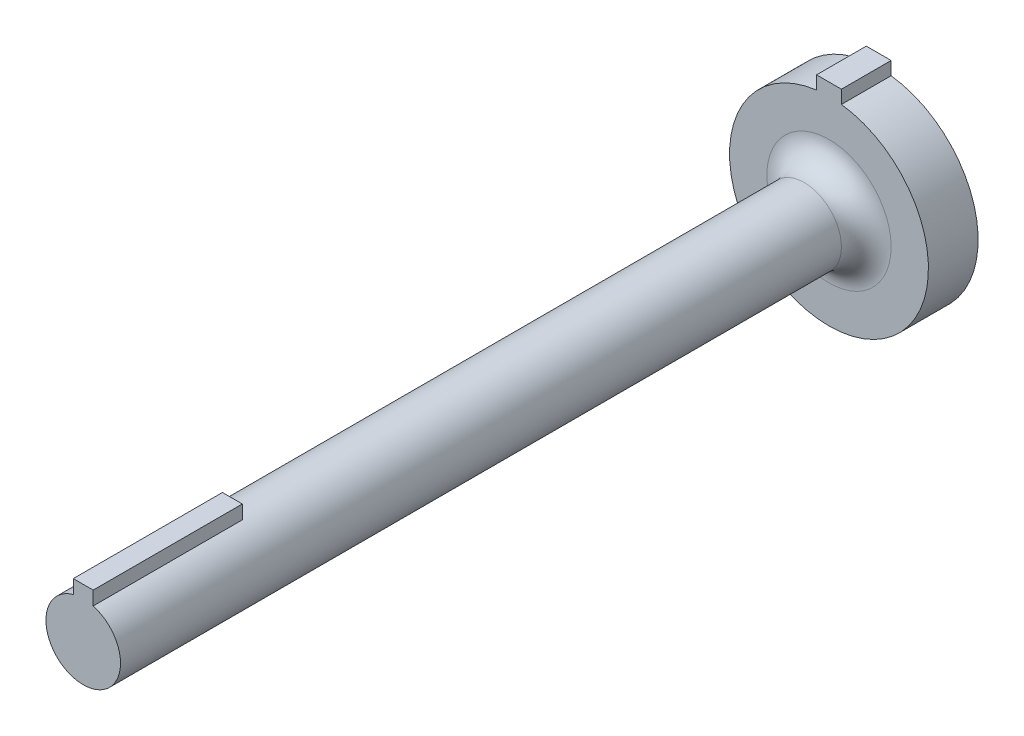
from build123d import *

# Parameters (mm, degrees)
SKETCH2_W           = 12.7
SKETCH2_H           = 25.4
BOSS_EXTRUDE2_DEPTH = 57.15
SKETCH3_W           = 10.16
SKETCH3_H           = 76.2
BOSS_EXTRUDE3_DEPTH = 25.4


with BuildPart() as part:
    # Sketch2 → Boss-Extrude2 (new body)
    with BuildSketch(Plane(origin=(0, 0, 0), x_dir=(1, 0, 0), z_dir=(0, 1, 0))):
        with Locations((0, -12.7)):
            Rectangle(SKETCH2_W, SKETCH2_H)
    extrude(amount=BOSS_EXTRUDE2_DEPTH)



with BuildPart() as body_2:
    # Sketch3 → Boss-Extrude3 (new body)
    with BuildSketch(Plane(origin=(0, 0, 0), x_dir=(1, 0, 0), z_dir=(0, 1, 0))):
        with Locations((0, -368.3)):
            Rectangle(SKETCH3_W, SKETCH3_H)
    extrude(amount=BOSS_EXTRUDE3_DEPTH)


with BuildPart() as part_1:
    add(part.part)

    add(body_2.part)  # Revolve2 merges body 2
    # Sketch4 → Revolve2 (revolve)
    with BuildSketch(Plane(origin=(0, 0, 0), x_dir=(0, 0, -1), z_dir=(1, 0, 0)), mode=Mode.PRIVATE) as revolve2_sk:
        with BuildLine():
            Line((0, 0), (0, 50.8))
            Line((0, 50.8), (-25.4, 50.8))
            Line((-25.4, 50.8), (-25.4, 31.75))
            ThreePointArc((-25.4, 31.75), (-29.119743879, 22.769743879), (-38.1, 19.05))
            Line((-38.1, 19.05), (-406.4, 19.05))
            Line((-406.4, 19.05), (-406.4, 0))
            Line((-406.4, 0), (0, 0))
        make_face()
    revolve(revolve2_sk.sketch.rotate(Axis((0, 0, 1000), (0, 0, -1)), 90), axis=Axis((0, 0, 1000), (0, 0, -1)))


solid = part_1.part
